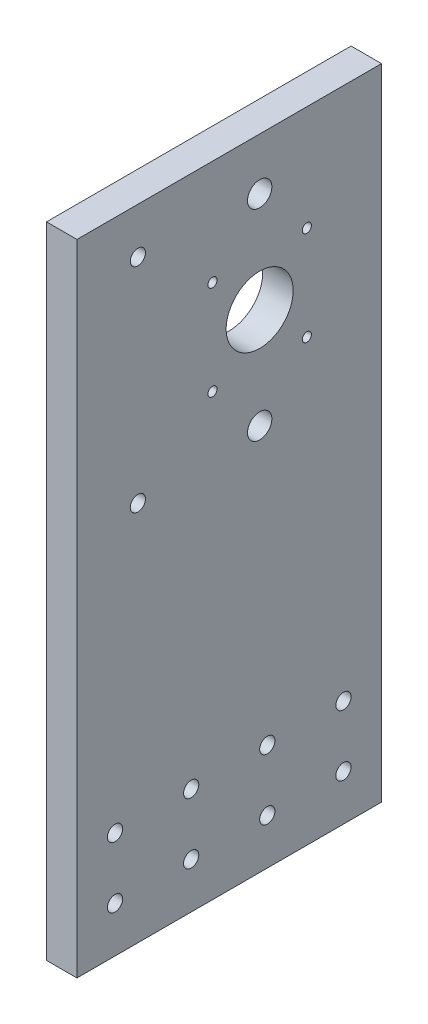
from build123d import *

# Parameters (mm, degrees)
SKETCH2_W                   = 100
SKETCH2_H                   = 210
SKETCH2_R                   = 4
BOSS_EXTRUDE1_DEPTH         = 10
SKETCH3_R                   = 2.5
MOUNT_DEPTH                 = 122.346610995
SKETCH7_R                   = 2.5
SUPPORT_PROFILE_MOUNT_DEPTH = 122.346610995
SKETCH4_R                   = 11
SKETCH4_R_2                 = 1.5
STEPPER_MOUNT_DEPTH         = 122.346610995


with BuildPart() as part:
    # Sketch2 → Boss-Extrude1 (new body)
    with BuildSketch(Plane(origin=(0, 0, 0), x_dir=(0, 0, -1), z_dir=(1, 0, 0))):
        with Locations((-10, 0)):
            Rectangle(SKETCH2_W, SKETCH2_H)
        with Locations((0, 88)):
            Circle(SKETCH2_R, mode=Mode.SUBTRACT)
        with Locations(Location((0, 22, 0), (0, 0, 180))):
            Circle(SKETCH2_R, mode=Mode.SUBTRACT)
    extrude(amount=BOSS_EXTRUDE1_DEPTH)

    # Sketch3 → mount (cut, through all)
    with BuildSketch(Plane(origin=(10, 0, 0), x_dir=(0, 0, -1), z_dir=(1, 0, 0))):
        with Locations((-22.5, -70)):
            Circle(SKETCH3_R)
        with Locations(Location((-47.5, -70, 0), (0, 0, 180))):
            Circle(SKETCH3_R)
        with Locations((-47.5, -90)):
            Circle(SKETCH3_R)
        with Locations(Location((-22.5, -90, 0), (0, 0, 180))):
            Circle(SKETCH3_R)
        with Locations((2.5, -90)):
            Circle(SKETCH3_R)
        with Locations(Location((27.5, -90, 0), (0, 0, 180))):
            Circle(SKETCH3_R)
        with Locations((27.5, -70)):
            Circle(SKETCH3_R)
        with Locations(Location((2.5, -70, 0), (0, 0, 180))):
            Circle(SKETCH3_R)
    extrude(amount=-MOUNT_DEPTH, mode=Mode.SUBTRACT)

    # Sketch7 → support_profile_mount (cut, through all)
    with BuildSketch(Plane(origin=(10, 0, 0), x_dir=(0, 0, -1), z_dir=(1, 0, 0))):
        with Locations((-40, 90)):
            Circle(SKETCH7_R)
        with Locations(Location((-40, 20, 0), (0, 0, 180))):
            Circle(SKETCH7_R)
    extrude(amount=-SUPPORT_PROFILE_MOUNT_DEPTH, mode=Mode.SUBTRACT)

    # Sketch4 → stepper_mount (cut, through all)
    with BuildSketch(Plane(origin=(10, 0, 0), x_dir=(0, 0, -1), z_dir=(1, 0, 0))):
        with Locations((0, 55)):
            Circle(SKETCH4_R)
        with Locations((-15.5, 70.5)):
            Circle(SKETCH4_R_2)
        with Locations(Location((15.5, 70.5, 0), (0, 0, 180))):
            Circle(SKETCH4_R_2)
        with Locations(Location((-15.5, 39.5, 0), (0, 0, 180))):
            Circle(SKETCH4_R_2)
        with Locations((15.5, 39.5)):
            Circle(SKETCH4_R_2)
    extrude(amount=-STEPPER_MOUNT_DEPTH, mode=Mode.SUBTRACT)


solid = part.part
